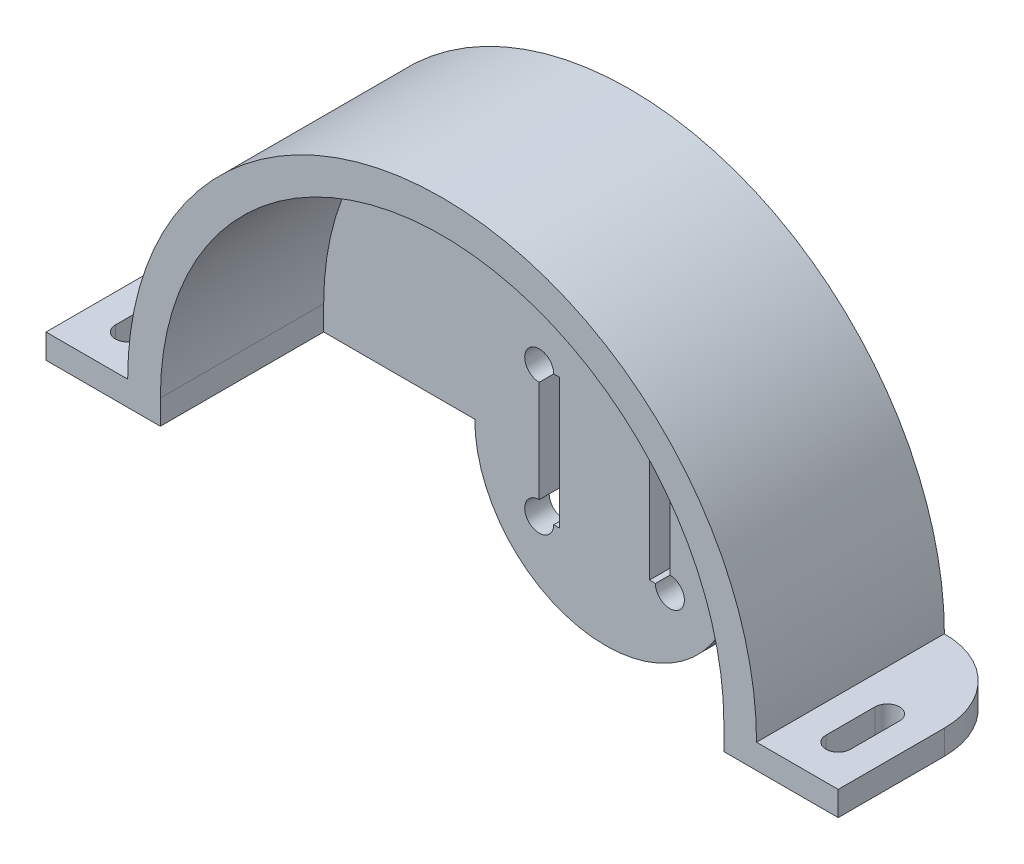
from build123d import *

# Parameters (mm, degrees)
BOSS_EXTRU_1_DEPTH      = 3
BOSS_EXTRU_2_DEPTH      = 20
BOSS_EXTRU_3_DEPTH      = 3
ENL_V_MAT_EXTRU_2_DEPTH = 10
ENL_V_MAT_EXTRU_3_DEPTH = 10
CONG_1_R                = 10
CONG_2_R                = 10


with BuildPart() as part:
    # Esquisse1 → Boss.-Extru.1 (new body)
    with BuildSketch(Plane.XY):
        with BuildLine():
            Line((10, 0), (0, 0))
            Line((0, 0), (0, -3))
            Line((0, -3), (97, -3))
            Line((97, -3), (97, 0))
            Line((97, 0), (87, 0))
            ThreePointArc((87, 0), (48.5, 38.5), (10, 0))
        make_face()
    extrude(amount=BOSS_EXTRU_1_DEPTH)

    # Esquisse2 → Boss.-Extru.2 (add)
    with BuildSketch(Plane.XY.offset(3)):
        with BuildLine():
            Line((10, 0), (0, 0))
            Line((0, 0), (0, -3))
            Line((0, -3), (14, -3))
            Line((14, -3), (14, 0))
            ThreePointArc((14, 0), (48.5, 34.5), (83, 0))
            Line((83, 0), (83, -3))
            Line((83, -3), (97, -3))
            Line((97, -3), (97, 0))
            Line((97, 0), (87, 0))
            ThreePointArc((87, 0), (48.5, 38.5), (10, 0))
        make_face()
    extrude(amount=BOSS_EXTRU_2_DEPTH)

    # Esquisse4 → Boss.-Extru.3 (add)
    with BuildSketch(Plane(origin=(0, 0, 0), x_dir=(-1, 0, 0), z_dir=(0, 0, -1))):
        with BuildLine():
            Line((-64.5, -3), (-32.5, -3))
            ThreePointArc((-32.5, -3), (-48.5, -19), (-64.5, -3))
        make_face()
    extrude(amount=-BOSS_EXTRU_3_DEPTH)

    # Esquisse7 → Enlèv. mat.-Extru.2 (cut)
    with BuildSketch(Plane(origin=(0, 0, 0), x_dir=(1, 0, 0), z_dir=(0, 1, 0))):
        with BuildLine():
            Line((3.5, -18), (3.5, -12))
            ThreePointArc((3.5, -12), (5, -10.5), (6.5, -12))
            Line((6.5, -12), (6.5, -18))
            ThreePointArc((6.5, -18), (5, -19.5), (3.5, -18))
        make_face()
        with BuildLine():
            Line((90.5, -18), (90.5, -12))
            ThreePointArc((90.5, -12), (92, -10.5), (93.5, -12))
            Line((93.5, -12), (93.5, -18))
            ThreePointArc((93.5, -18), (92, -19.5), (90.5, -18))
        make_face()
    extrude(amount=-ENL_V_MAT_EXTRU_2_DEPTH, mode=Mode.SUBTRACT)

    # Esquisse9 → Enlèv. mat.-Extru.3 (cut)
    with BuildSketch(Plane.XY.offset(3)):
        with BuildLine():
            ThreePointArc((42.16513432, 6.64), (39.135019783, 7.895114537), (40.39013432, 4.865))
            Line((40.39013432, 4.865), (40.39013432, -7.585))
            ThreePointArc((40.39013432, -7.585), (39.135019783, -10.615114537), (42.16513432, -9.36))
            Line((42.16513432, -9.36), (42.89013432, -9.36))
            Line((42.89013432, -9.36), (42.89013432, 6.64))
            Line((42.89013432, 6.64), (42.16513432, 6.64))
        make_face()
        with BuildLine():
            Line((56.39013432, -7.585), (56.39013432, 4.865))
            ThreePointArc((56.39013432, 4.865), (57.645248856, 7.895114537), (54.61513432, 6.64))
            Line((54.61513432, 6.64), (53.89013432, 6.64))
            Line((53.89013432, 6.64), (53.89013432, -9.36))
            Line((53.89013432, -9.36), (54.61513432, -9.36))
            ThreePointArc((54.61513432, -9.36), (57.645248856, -10.615114537), (56.39013432, -7.585))
        make_face()
    extrude(amount=-ENL_V_MAT_EXTRU_3_DEPTH, mode=Mode.SUBTRACT)

    # Congé1
    cong_1_edges = [part.edges().sort_by_distance(p)[0] for p in [
        (97, -1.5, 0),
    ]]
    fillet(cong_1_edges, radius=CONG_1_R)

    # Congé2
    cong_2_edges = [part.edges().sort_by_distance(p)[0] for p in [
        (0, -1.5, 0),
    ]]
    fillet(cong_2_edges, radius=CONG_2_R)


solid = part.part
